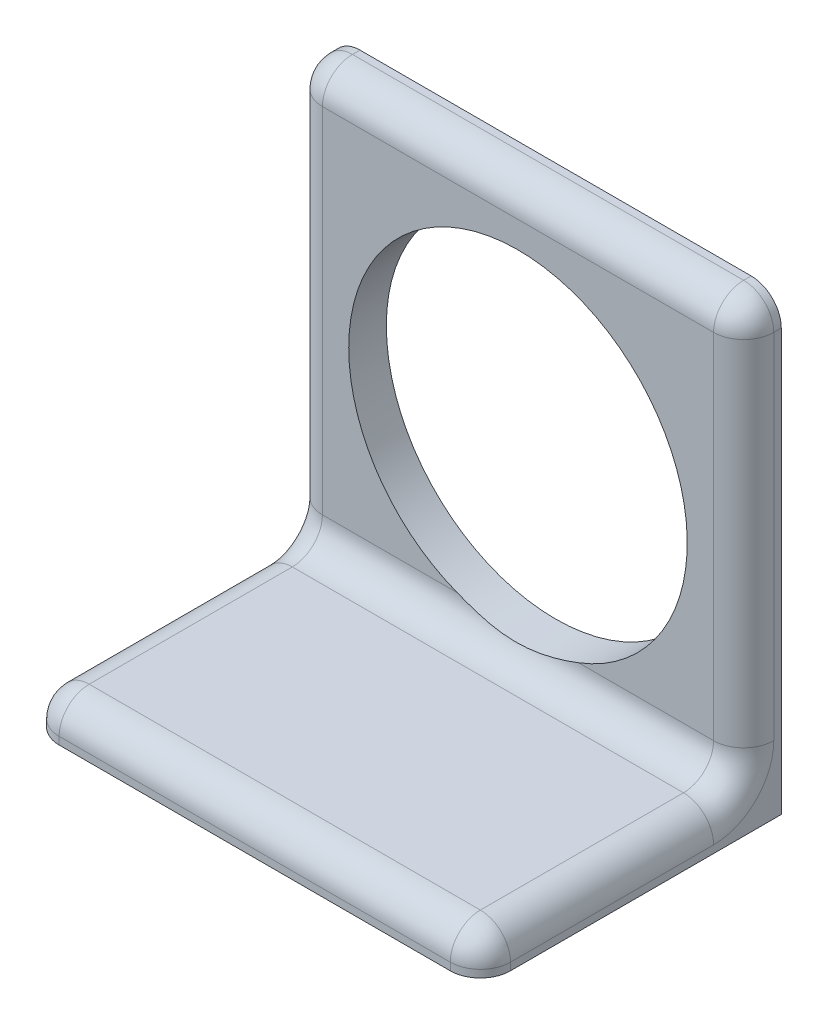
from build123d import *

# Parameters (mm, degrees)
SKETCH2_W           = 38.1
SKETCH2_H           = 38.1
BOSS_EXTRUDE1_DEPTH = 3.175
SKETCH3_W           = 38.1
SKETCH3_H           = 3.175
BOSS_EXTRUDE2_DEPTH = 22.225
FILLET1_R           = 2.54
SKETCH4_R           = 14.2875
CUT_EXTRUDE1_DEPTH  = 60.56828015


with BuildPart() as part:
    # Sketch2 → Boss-Extrude1 (new body)
    with BuildSketch(Plane.XY):
        with Locations((19.05, 19.05)):
            Rectangle(SKETCH2_W, SKETCH2_H)
    extrude(amount=BOSS_EXTRUDE1_DEPTH)

    # Sketch3 → Boss-Extrude2 (add)
    with BuildSketch(Plane.XY.offset(3.175)):
        with Locations((19.05, 1.5875)):
            Rectangle(SKETCH3_W, SKETCH3_H)
    extrude(amount=BOSS_EXTRUDE2_DEPTH)

    # Fillet1
    fillet1_edges = [part.edges().sort_by_distance(p)[0] for p in [
        (19.05, 38.1, 3.175),
        (38.1, 20.6375, 3.175),
        (0, 3.175, 14.2875),
        (19.05, 3.175, 3.175),
        (38.1, 3.175, 14.2875),
        (0, 1.5875, 25.4),
        (38.1, 1.5875, 25.4),
        (19.05, 3.175, 25.4),
        (0, 20.6375, 3.175),
        (0, 38.1, 1.5875),
        (38.1, 38.1, 1.5875),
    ]]
    fillet(fillet1_edges, radius=FILLET1_R)

    # Sketch4 → Cut-Extrude1 (cut, through all)
    with BuildSketch(Plane(origin=(0, 0, 0), x_dir=(-1, 0, 0), z_dir=(0, 0, -1))):
        with Locations((-19.05, 19.05)):
            Circle(SKETCH4_R)
    extrude(amount=-CUT_EXTRUDE1_DEPTH, mode=Mode.SUBTRACT)


solid = part.part
